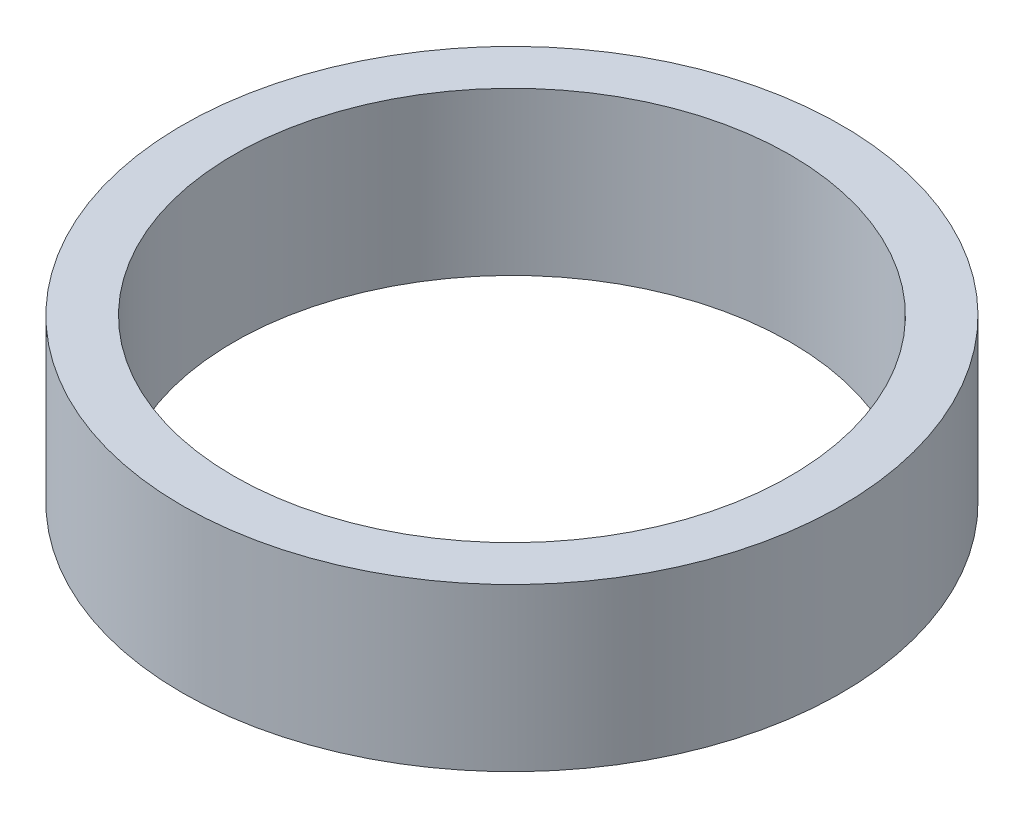
from build123d import *

# Parameters (mm, degrees)
SKETCH1_R           = 6.1
SKETCH1_R_2         = 5.15
BOSS_EXTRUDE1_DEPTH = 3


with BuildPart() as part:
    # Sketch1 → Boss-Extrude1 (new body)
    with BuildSketch(Plane(origin=(0, 0, 0), x_dir=(1, 0, 0), z_dir=(0, 1, 0))):
        with Locations(Location((0, 0, 0), (0, 0, 270))):
            Circle(SKETCH1_R)
        with Locations(Location((0, 0, 0), (0, 0, 270))):
            Circle(SKETCH1_R_2, mode=Mode.SUBTRACT)
    extrude(amount=BOSS_EXTRUDE1_DEPTH)


solid = part.part
